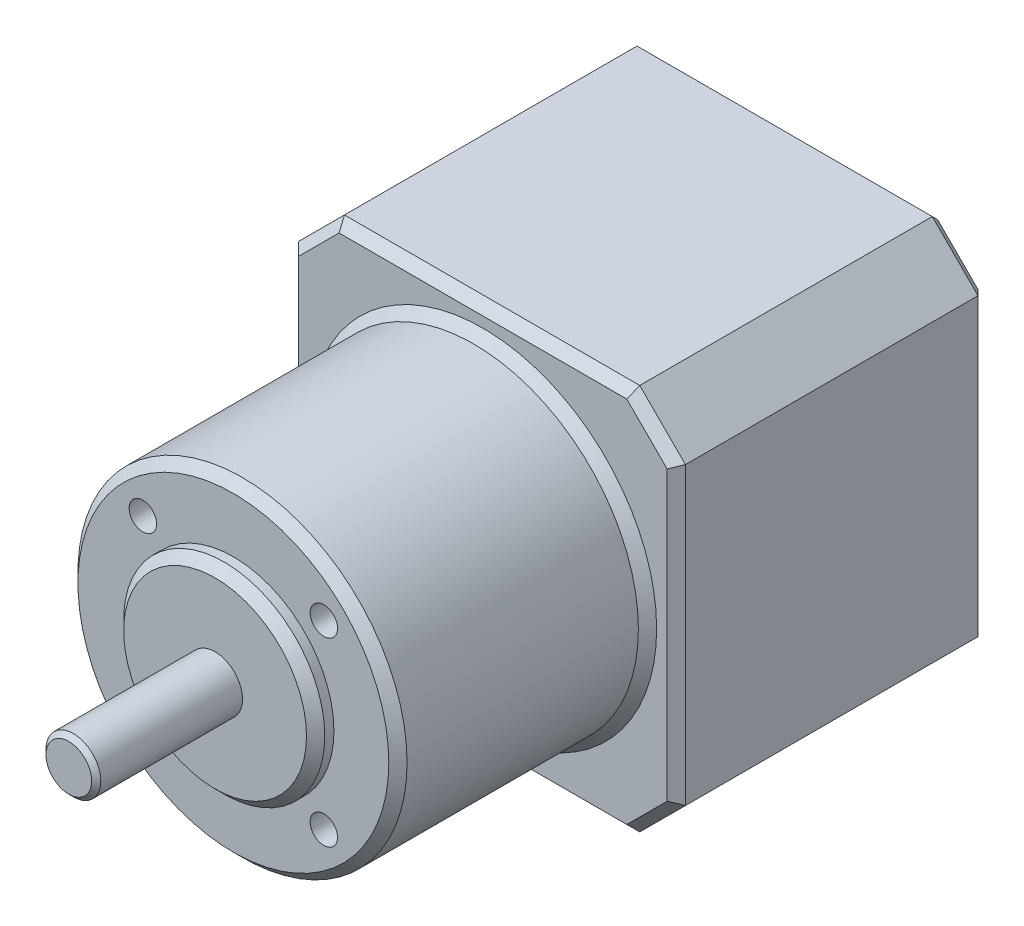
from build123d import *

# Parameters (mm, degrees)
SKETCH1_W           = 42.3
SKETCH1_H           = 42.3
BOSS_EXTRUDE1_DEPTH = 34
CHAMFER1_SIZE       = 5
SKETCH2_R           = 18
BOSS_EXTRUDE2_DEPTH = 27.3
SKETCH3_R           = 11
BOSS_EXTRUDE3_DEPTH = 2
SKETCH4_R           = 3
BOSS_EXTRUDE4_DEPTH = 16
CHAMFER2_SIZE       = 1
CHAMFER3_SIZE       = 0.5
SKETCH5_R           = 1.5
CUT_EXTRUDE1_DEPTH  = 5
ECHELLE1_SCALE      = 2
ECHELLE2_SCALE      = 0.25


with BuildPart() as part:
    # Sketch1 → Boss-Extrude1 (new body)
    with BuildSketch(Plane.XY):
        Rectangle(SKETCH1_W, SKETCH1_H)
    extrude(amount=BOSS_EXTRUDE1_DEPTH)

    # Chamfer1
    chamfer1_edges = [part.edges().sort_by_distance(p)[0] for p in [
        (21.15, -21.15, 17),
        (-21.15, -21.15, 17),
        (-21.15, 21.15, 17),
        (21.15, 21.15, 17),
    ]]
    chamfer(chamfer1_edges, length=CHAMFER1_SIZE)

    # Sketch2 → Boss-Extrude2 (add)
    with BuildSketch(Plane.XY.offset(34)):
        Circle(SKETCH2_R)
    extrude(amount=BOSS_EXTRUDE2_DEPTH)

    # Sketch3 → Boss-Extrude3 (add)
    with BuildSketch(Plane.XY.offset(61.3)):
        Circle(SKETCH3_R)
    extrude(amount=BOSS_EXTRUDE3_DEPTH)

    # Sketch4 → Boss-Extrude4 (add)
    with BuildSketch(Plane.XY.offset(63.3)):
        Circle(SKETCH4_R)
    extrude(amount=BOSS_EXTRUDE4_DEPTH)

    # Chamfer2
    chamfer2_edges = [part.edges().sort_by_distance(p)[0] for p in [
        (0, -21.15, 0),
        (0, -21.15, 34),
        (21.15, 0, 0),
        (-21.15, 0, 0),
        (0, 21.15, 0),
        (18.65, 18.65, 0),
        (18.65, -18.65, 0),
        (-18.65, 18.65, 0),
        (-18.65, -18.65, 0),
        (-21.15, 0, 34),
        (21.15, 0, 34),
        (0, 21.15, 34),
        (18.65, 18.65, 34),
        (18.65, -18.65, 34),
        (-18.65, 18.65, 34),
        (-18.65, -18.65, 34),
        (-18, 0, 34),
        (-18, 0, 61.3),
        (-11, 0, 63.3),
    ]]
    chamfer(chamfer2_edges, length=CHAMFER2_SIZE)

    # Chamfer3
    chamfer3_edges = [part.edges().sort_by_distance(p)[0] for p in [
        (-3, 0, 79.3),
    ]]
    chamfer(chamfer3_edges, length=CHAMFER3_SIZE)

    # Sketch5 → Cut-Extrude1 (cut)
    with BuildSketch(Plane.XY.offset(61.3)):
        with Locations((9.899494937, 9.899494937)):
            Circle(SKETCH5_R)
        with Locations((9.899494937, -9.899494937)):
            Circle(SKETCH5_R)
        with Locations((-9.899494937, -9.899494937)):
            Circle(SKETCH5_R)
        with Locations((-9.899494937, 9.899494937)):
            Circle(SKETCH5_R)
    extrude(amount=-CUT_EXTRUDE1_DEPTH, mode=Mode.SUBTRACT)


with BuildPart() as part_1:
    # Echelle1: scaled about (0, 0, 27.268947418)
    add(part.part.scale(ECHELLE1_SCALE).moved(Location((0, 0, -27.268947418))))


with BuildPart() as part_2:
    # Echelle2: scaled about (0, 0, 27.268947418)
    add(part_1.part.scale(ECHELLE2_SCALE).moved(Location((0, 0, 20.451710564))))


solid = part_2.part
